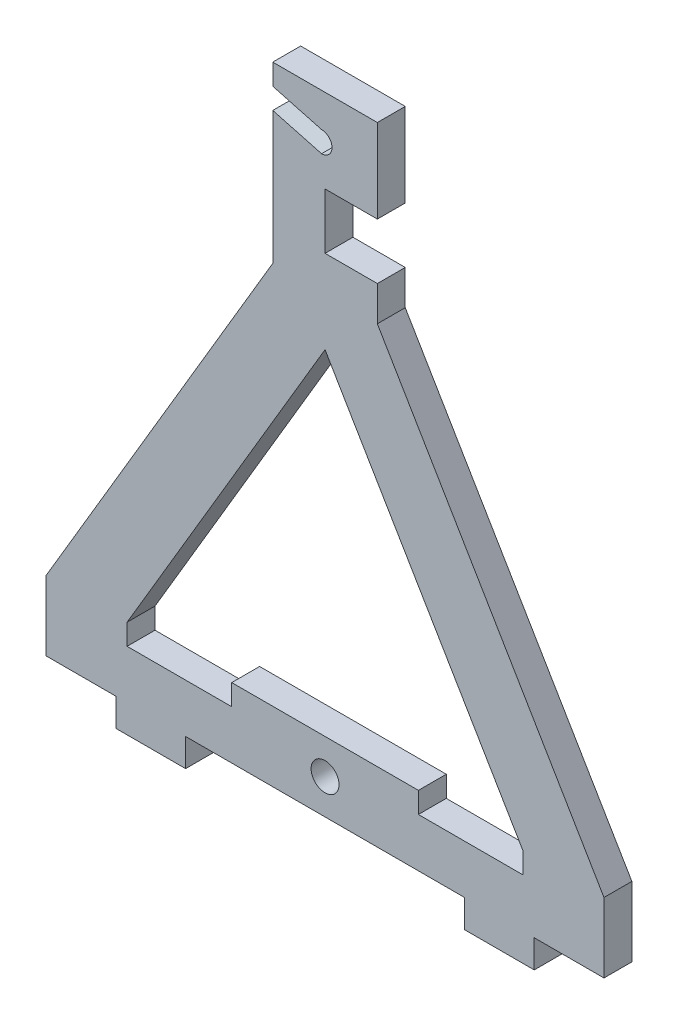
from build123d import *

# Parameters (mm, degrees)
SKETCH1_R           = 4
BOSS_EXTRUDE1_DEPTH = 8
SKETCH2_W           = 20
SKETCH2_H           = 8
BOSS_EXTRUDE2_DEPTH = 8
SKETCH4_W           = 15
SKETCH4_H           = 16
CUT_EXTRUDE1_DEPTH  = 10
SKETCH5_W           = 30
SKETCH5_H           = 6
CUT_EXTRUDE2_DEPTH  = 8
CUT_EXTRUDE4_DEPTH  = 198.139544486


with BuildPart() as part:
    # Sketch1 → Boss-Extrude1 (new body)
    with BuildSketch(Plane.XY):
        Polygon((-80, 0), (80, 0), (80, 20), (15, 130), (15, 180), (-15, 180), (-15, 130), (-80, 20), align=None)
        with Locations((0, 10)):
            Circle(SKETCH1_R, mode=Mode.SUBTRACT)
        Polygon((-56.769213929, 20), (0, 116.070977418), (56.769213929, 20), align=None, mode=Mode.SUBTRACT)
    extrude(amount=BOSS_EXTRUDE1_DEPTH)

    # Sketch2 → Boss-Extrude2 (add)
    with BuildSketch(Plane.XZ):
        with Locations((-50, 4)):
            Rectangle(SKETCH2_W, SKETCH2_H)
    boss_extrude2 = extrude(amount=BOSS_EXTRUDE2_DEPTH)

    # Mirror1: Boss-Extrude2 across plane
    add(boss_extrude2.mirror(Plane(origin=(0, 0, 0), x_dir=(0, 0, 1), z_dir=(1, 0, 0))))

    # Sketch4 → Cut-Extrude1 (cut)
    with BuildSketch(Plane.XY.offset(8)):
        with Locations((7.5, 148)):
            Rectangle(SKETCH4_W, SKETCH4_H)
    extrude(amount=-CUT_EXTRUDE1_DEPTH, mode=Mode.SUBTRACT)

    # Sketch5 → Cut-Extrude2 (cut)
    with BuildSketch(Plane.XY.offset(8)):
        with Locations((-41.769213929, 17)):
            Rectangle(SKETCH5_W, SKETCH5_H)
    cut_extrude2 = extrude(amount=-CUT_EXTRUDE2_DEPTH, mode=Mode.SUBTRACT)

    # Mirror2: Cut-Extrude2 across plane
    add(cut_extrude2.mirror(Plane(origin=(0, 0, 0), x_dir=(0, 0, 1), z_dir=(1, 0, 0))), mode=Mode.SUBTRACT)

    # Sketch7 → Cut-Extrude4 (cut, through all)
    with BuildSketch(Plane.XY.offset(8)):
        with BuildLine():
            Line((-15, 174), (-1, 170.248711306))
            ThreePointArc((-1, 170.248711306), (2, 167.248711306), (-1, 164.248711306))
            Line((-1, 164.248711306), (-15, 168))
            Line((-15, 168), (-15, 174))
        make_face()
    extrude(amount=-CUT_EXTRUDE4_DEPTH, mode=Mode.SUBTRACT)


solid = part.part
